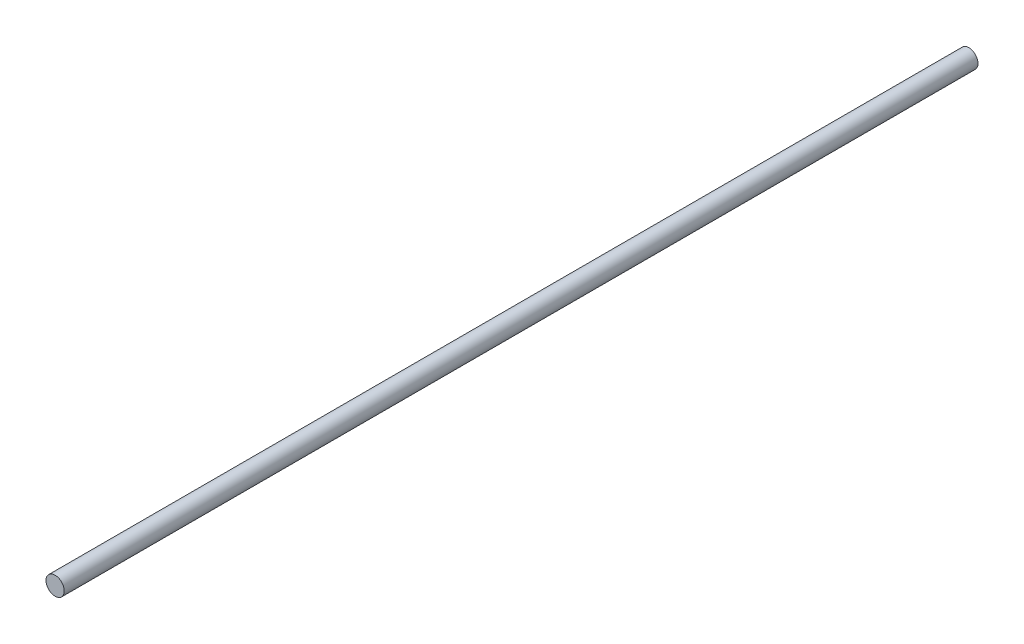
from build123d import *

# Parameters (mm, degrees)
ESQUISSE1_R        = 0.4
BOSS_EXTRU_1_DEPTH = 40


with BuildPart() as part:
    # Esquisse1 → Boss.-Extru.1 (new body)
    with BuildSketch(Plane.XY):
        with Locations((-68.931589277, -191.226652221)):
            Circle(ESQUISSE1_R)
    extrude(amount=-BOSS_EXTRU_1_DEPTH)


solid = part.part
